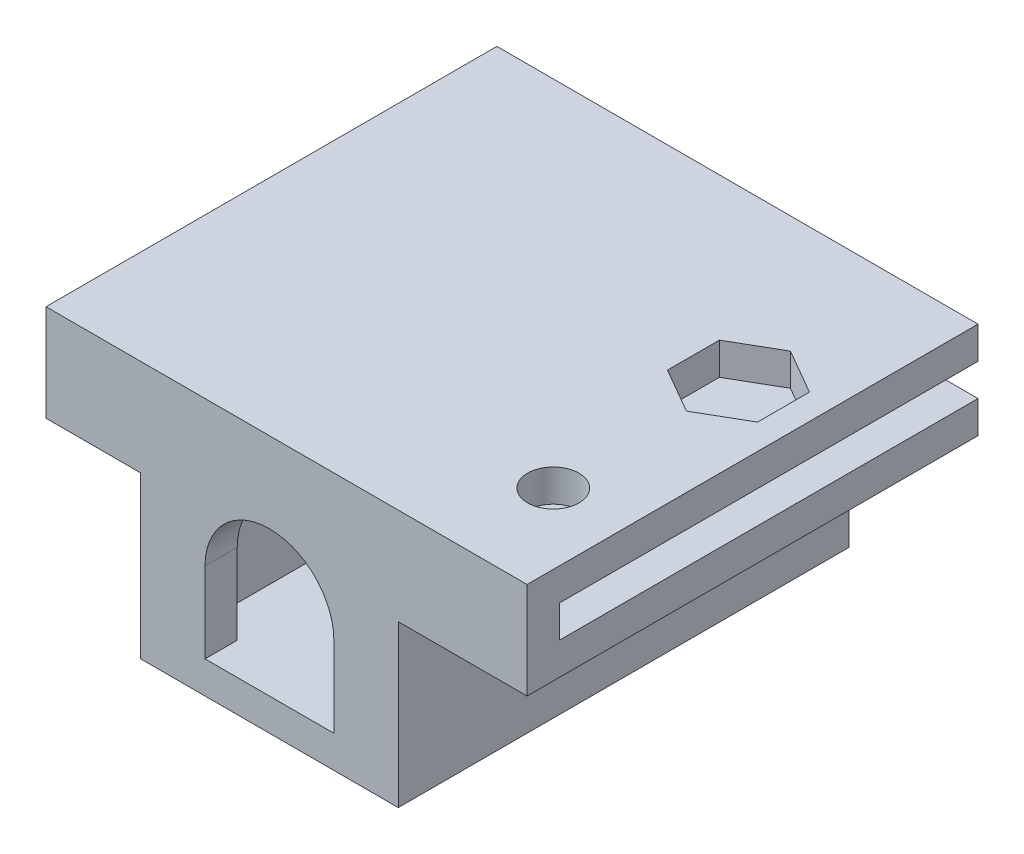
from build123d import *

# Parameters (mm, degrees)
EXTRUDE_1_DEPTH          = 2
EXTRUDE_2_DEPTH          = 26
SKETCH_3_W               = 12
SKETCH_3_H               = 1
EXTRUDE_3_DEPTH          = 1.6
CUT_EXTRUDE_1_DEPTH      = 2
CUT_EXTRUDE_2_DEPTH      = 0.5
CUT_EXTRUDE_3_DEPTH      = 1
CUT_EXTRUDE_4_DEPTH      = 1
CUT_EXTRUDE_4_DEPTH_BACK = 33.449961479
SKETCH_7_R               = 1.35
SKETCH_7_R_2             = 1.6


with BuildPart() as part:
    # 草图1 → 凸台-拉伸1 (new body)
    with BuildSketch(Plane.XY):
        with BuildLine():
            Line((8, -7), (8, 3))
            Line((8, 3), (16, 3))
            Line((16, 3), (16, 5))
            Line((16, 5), (8, 5))
            Line((8, 5), (5, 5))
            ThreePointArc((5, 5), (5.707106781, 4.707106781), (6, 4))
            Line((6, 4), (6, -4))
            ThreePointArc((6, -4), (5.707106781, -4.707106781), (5, -5))
            Line((5, -5), (4, -5))
            Line((4, -5), (-4, -5))
            Line((-4, -5), (-5, -5))
            ThreePointArc((-5, -5), (-5.707106781, -4.707106781), (-6, -4))
            Line((-6, -4), (-6, 4))
            ThreePointArc((-6, 4), (-5.707106781, 4.707106781), (-5, 5))
            Line((-5, 5), (-8, 5))
            Line((-8, 5), (-11.875, 5))
            Line((-11.875, 5), (-11.875, 7))
            Line((-11.875, 7), (16, 7))
            Line((16, 7), (16, 9))
            Line((16, 9), (-13.875, 9))
            Line((-13.875, 9), (-13.875, 3))
            Line((-13.875, 3), (-8, 3))
            Line((-8, 3), (-8, -7))
            Line((-8, -7), (8, -7))
        make_face()
        Polygon((8, 5), (16, 5), (16, 7), (-11.875, 7), (-11.875, 5), (-8, 5), (-5, 5), (5, 5), align=None)
        with BuildLine():
            ThreePointArc((6, 4), (5.707106781, 4.707106781), (5, 5))
            Line((5, 5), (-5, 5))
            ThreePointArc((-5, 5), (-5.707106781, 4.707106781), (-6, 4))
            Line((-6, 4), (-6, -4))
            ThreePointArc((-6, -4), (-5.707106781, -4.707106781), (-5, -5))
            Line((-5, -5), (-4, -5))
            Line((-4, -5), (-4, 0))
            ThreePointArc((-4, 0), (0, 4), (4, 0))
            Line((4, 0), (4, -5))
            Line((4, -5), (5, -5))
            ThreePointArc((5, -5), (5.707106781, -4.707106781), (6, -4))
            Line((6, -4), (6, 4))
        make_face()
    extrude(amount=EXTRUDE_1_DEPTH)

    # 草图2 → 凸台-拉伸2 (add)
    with BuildSketch(Plane(origin=(0, 0, 0), x_dir=(-1, 0, 0), z_dir=(0, 0, -1))):
        Polygon((6, -4), (6, -5), (5, -5), (-5, -5), (-6, -5), (-6, -4), (-6, 4), (-6, 5), (-16, 5), (-16, 3), (-8, 3), (-8, -7), (8, -7), (8, 3), (13.875, 3), (13.875, 9), (-16, 9), (-16, 7), (11.875, 7), (11.875, 5), (6, 5), (6, 4), align=None)
    extrude(amount=EXTRUDE_2_DEPTH)

    # 草图3 → 凸台-拉伸3 (add)
    with BuildSketch(Plane(origin=(0, 0, -26), x_dir=(-1, 0, 0), z_dir=(0, 0, -1))):
        with Locations((0, -4.5)):
            Rectangle(SKETCH_3_W, SKETCH_3_H)
    extrude(amount=-EXTRUDE_3_DEPTH)

    # 草图4 → 切除-拉伸1 (cut)
    with BuildSketch(Plane(origin=(0, 9, 0), x_dir=(1, 0, 0), z_dir=(0, 1, 0))):
        Polygon((11.625, 12.272649731), (14.41996732, 13.886324865), (14.41996732, 17.113675135), (11.625, 18.727350269), (8.83003268, 17.113675135), (8.83003268, 13.886324865), align=None)
    extrude(amount=-CUT_EXTRUDE_1_DEPTH, mode=Mode.SUBTRACT)

    # 草图5 → 切除-拉伸2 (cut)
    with BuildSketch(Plane.XZ.offset(-3)):
        Polygon((11.625, -18.675426481), (14.375, -17.08771324), (14.375, -13.91228676), (11.625, -12.324573519), (8.875, -13.91228676), (8.875, -17.08771324), align=None)
    extrude(amount=-CUT_EXTRUDE_2_DEPTH, mode=Mode.SUBTRACT)

    # 草图6 → 切除-拉伸3 (cut)
    with BuildSketch(Plane.XZ.offset(-3)):
        Polygon((8.625, -5.732050808), (11.625, -7.464101615), (14.625, -5.732050808), (14.625, -2.267949192), (11.625, -0.535898385), (8.625, -2.267949192), align=None)
    extrude(amount=-CUT_EXTRUDE_3_DEPTH, mode=Mode.SUBTRACT)

    # 草图7 → 切除-拉伸4 (cut, two sides: drawn at the far end of the back side and taken through both)
    with BuildSketch(Plane.XZ.offset(-4).offset(-CUT_EXTRUDE_4_DEPTH_BACK)):
        with Locations(Location((11.625, -15.5, 0), (0, 0, 180))):
            Circle(SKETCH_7_R)
        with Locations(Location((11.625, -4, 0), (0, 0, 180))):
            Circle(SKETCH_7_R_2)
    extrude(amount=CUT_EXTRUDE_4_DEPTH + CUT_EXTRUDE_4_DEPTH_BACK, mode=Mode.SUBTRACT)


solid = part.part
